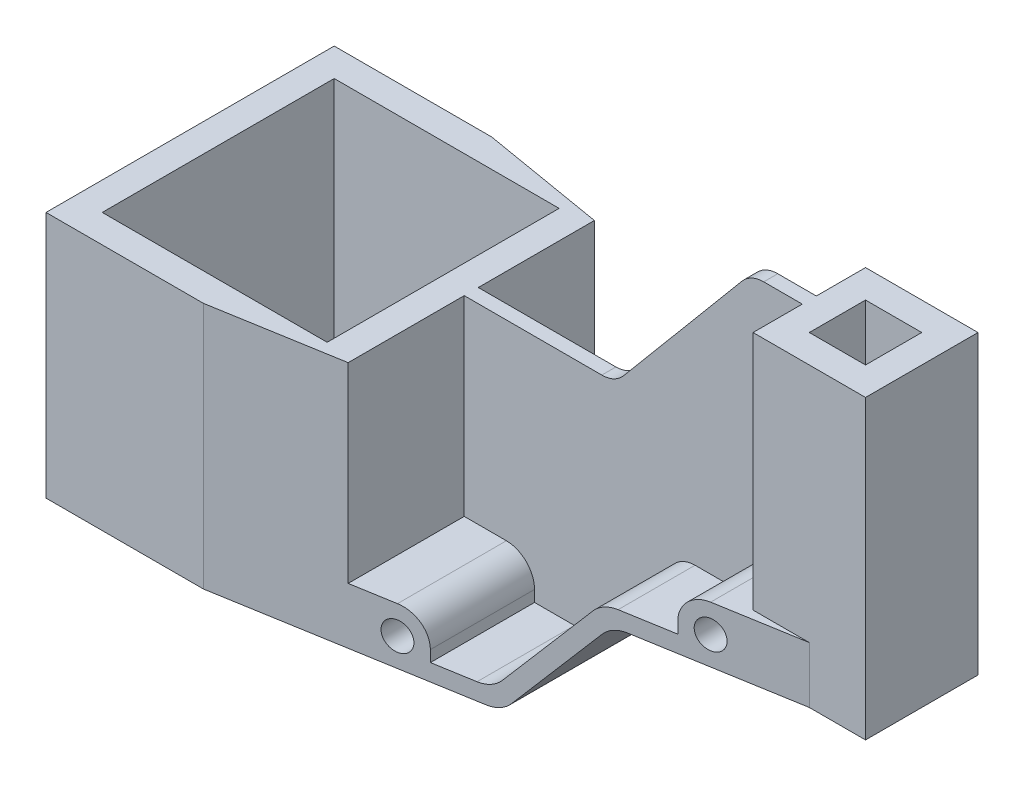
from build123d import *
from build123d.topology import SkipClean

# Parameters (mm, degrees)
ESQUISSE1_W                   = 100
ESQUISSE1_H                   = 102.5
ESQUISSE1_W_2                 = 80
ESQUISSE1_H_2                 = 82.5
BOSS_EXTRU_3_DEPTH            = 88
BOSS_EXTRU_4_DEPTH            = 102.5
ESQUISSE7_W                   = 40
ESQUISSE7_H                   = 40
ESQUISSE7_W_2                 = 20
ESQUISSE7_H_2                 = 20
BOSS_EXTRU_11_DEPTH           = 105.5
ENL_V_MAT_EXTRU_9_REACH       = 240.16
ESQUISSE13_W                  = 10
ESQUISSE13_H                  = 20
BOSS_EXTRU_12_DEPTH           = 2.5
ESQUISSE17_R                  = 5
ESQUISSE17_W                  = 40
ESQUISSE17_H                  = 20
BOSS_EXTRU_13_DEPTH           = 51.25
ENL_V_MAT_EXTRU_12_DEPTH      = 262.252326841
ENL_V_MAT_EXTRU_12_DEPTH_BACK = 262.252326841
ESQUISSE18_R                  = 5
ENL_V_MAT_EXTRU_13_REACH      = 234.659
ESQUISSE19_W                  = 10
ESQUISSE19_H                  = 20
CONG_1_R                      = 10
ENL_V_MAT_EXTRU_15_DEPTH      = 88


with BuildPart() as part:
    # Esquisse1 → Boss.-Extru.3 (new body)
    with BuildSketch(Plane(origin=(0, 0, 0), x_dir=(1, 0, 0), z_dir=(0, 1, 0))):
        Rectangle(ESQUISSE1_W, ESQUISSE1_H)
        Rectangle(ESQUISSE1_W_2, ESQUISSE1_H_2, mode=Mode.SUBTRACT)
    extrude(amount=BOSS_EXTRU_3_DEPTH)

    # Esquisse3 → Boss.-Extru.4 (add)
    with BuildSketch(Plane.XY.offset(51.25)):
        Polygon((50, 6), (50, 0), (96.658434537, 0), (130.222419784, 40), (190.222419784, 40), (190.222419784, 46), (127.424573836, 46), (93.860588588, 6), align=None)
    extrude(amount=-BOSS_EXTRU_4_DEPTH)

    # Esquisse7 → Boss.-Extru.11 (add)
    with BuildSketch(Plane.XZ.offset(-40)):
        with Locations((190.222419784, 0)):
            Rectangle(ESQUISSE7_W, ESQUISSE7_H)
        with Locations((190.222419784, 0)):
            Rectangle(ESQUISSE7_W_2, ESQUISSE7_H_2, mode=Mode.SUBTRACT)
    extrude(amount=-BOSS_EXTRU_11_DEPTH)

    # Esquisse13 → Enlèv. mat.-Extru.9 (cut, up to next)
    with BuildSketch(Plane(origin=(0, 46, 0), x_dir=(1, 0, 0), z_dir=(0, 1, 0)), mode=Mode.PRIVATE) as enl_v_mat_extru_9_sk1:
        with Locations((185.222419784, 0)):
            Rectangle(ESQUISSE13_W, ESQUISSE13_H)
    enl_v_mat_extru_9_tool1 = extrude(enl_v_mat_extru_9_sk1.sketch, amount=-ENL_V_MAT_EXTRU_9_REACH, mode=Mode.PRIVATE) & part.part
    add(enl_v_mat_extru_9_tool1.solids().sort_by_distance((185.22242, 46, 0))[0], mode=Mode.SUBTRACT)

    # Esquisse14 → Boss.-Extru.12 (add, symmetric)
    with BuildSketch(Plane.XY):
        Polygon((50, 88), (103.597078503, 88), (151.845307295, 145.5), (170.222419784, 145.5), (170.222419784, 46), (127.424573836, 46), (93.860588588, 6), (50, 6), align=None)
    extrude(amount=BOSS_EXTRU_12_DEPTH, both=True)

    # Esquisse17 → Boss.-Extru.13 (add, symmetric)
    # profile 1 of 2: a face of its own
    with BuildSketch(Plane.XY):
        Polygon((44, 20), (44, 0), (75, 0), (75, 6), (75, 20), align=None)
        with Locations((65, 10)):
            Circle(ESQUISSE17_R, mode=Mode.SUBTRACT)
    # profile 2 of 2: a face of its own
    with BuildSketch(Plane.XY):
        with Locations((170.222419784, 50)):
            Rectangle(ESQUISSE17_W, ESQUISSE17_H)
        with Locations((160.222419784, 50)):
            Circle(ESQUISSE17_R, mode=Mode.SUBTRACT)
    extrude(amount=BOSS_EXTRU_13_DEPTH, both=True)

    # Esquisse18 → Enlèv. mat.-Extru.12 (cut, two sides: drawn at the far end of the back side and taken through both)
    with SkipClean():  # the faces are left unmerged after this step: merging them gives an invalid solid
        with BuildSketch(Plane.XY.offset(2.5).offset(-ENL_V_MAT_EXTRU_12_DEPTH_BACK)):
            with Locations(Location((160.222419784, 50, 0), (0, 0, 180))):
                Circle(ESQUISSE18_R)
            with Locations(Location((65, 10, 0), (0, 0, 180))):
                Circle(ESQUISSE18_R)
        extrude(amount=ENL_V_MAT_EXTRU_12_DEPTH + ENL_V_MAT_EXTRU_12_DEPTH_BACK, mode=Mode.SUBTRACT)

    # Esquisse19 → Enlèv. mat.-Extru.13 (cut, up to next)
    with BuildSketch(Plane(origin=(0, 60, 0), x_dir=(1, 0, 0), z_dir=(0, 1, 0)), mode=Mode.PRIVATE) as enl_v_mat_extru_13_sk1:
        with Locations((185.222419784, 0)):
            Rectangle(ESQUISSE19_W, ESQUISSE19_H)
    enl_v_mat_extru_13_tool1 = extrude(enl_v_mat_extru_13_sk1.sketch, amount=-ENL_V_MAT_EXTRU_13_REACH, mode=Mode.PRIVATE) & part.part
    add(enl_v_mat_extru_13_tool1.solids().sort_by_distance((185.22242, 60, 0))[0], mode=Mode.SUBTRACT)

    # Congé1
    cong_1_edges = [part.edges().sort_by_distance(p)[0] for p in [
        (93.860588588, 6, 26.875),
        (127.424573836, 46, 26.875),
        (151.845307295, 145.5, 0),
        (103.597078503, 88, 0),
        (75, 20, 26.875),
        (75, 20, -26.875),
        (150.222419784, 60, 26.875),
        (150.222419784, 60, -26.875),
        (127.424573836, 46, -26.875),
        (93.860588588, 6, -26.875),
        (96.658434537, 0, 0),
        (130.222419784, 40, 0),
    ]]
    fillet(cong_1_edges, radius=CONG_1_R)

    # Esquisse20 → Enlèv. mat.-Extru.15 (cut)
    with SkipClean():  # the faces are left unmerged after this step: merging them gives an invalid solid
        with BuildSketch(Plane(origin=(0, 0, 0), x_dir=(1, 0, 0), z_dir=(0, 1, 0))):
            Polygon((6, 51.25), (190.222419784, 20), (210.222419784, 20), (210.222419784, 51.25), align=None)
            Polygon((210.222419784, -20), (190.222419784, -20), (6, -51.25), (210.222419784, -51.25), align=None)
        extrude(amount=ENL_V_MAT_EXTRU_15_DEPTH, mode=Mode.SUBTRACT)


solid = part.part
